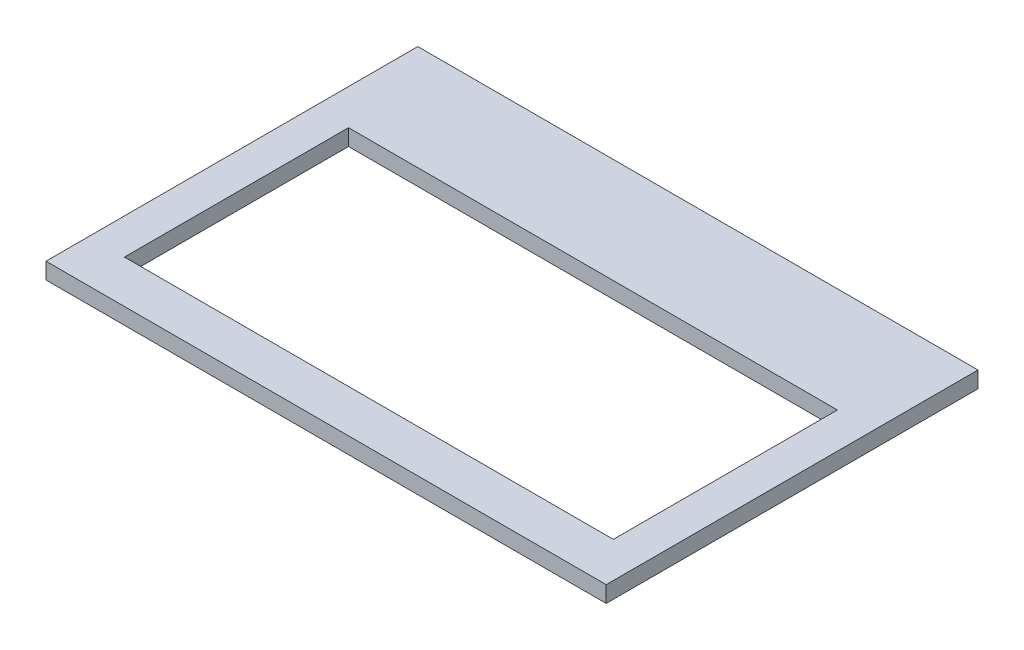
from build123d import *

# Parameters (mm, degrees)
SZKIC1_W                    = 550
SZKIC1_H                    = 365
DODANIE_WYCI_GNI_CIE1_DEPTH = 16
SZKIC2_W                    = 480
SZKIC2_H                    = 220
WYTNIJ_WYCI_GNI_CIE1_DEPTH  = 16


with BuildPart() as part:
    # Szkic1 → Dodanie-wyciągnięcie1 (new body)
    with BuildSketch(Plane(origin=(0, 0, 0), x_dir=(1, 0, 0), z_dir=(0, 1, 0))):
        Rectangle(SZKIC1_W, SZKIC1_H)
    extrude(amount=DODANIE_WYCI_GNI_CIE1_DEPTH)

    # Szkic2 → Wytnij-wyciągnięcie1 (cut)
    with BuildSketch(Plane(origin=(0, 16, 0), x_dir=(1, 0, 0), z_dir=(0, 1, 0))):
        with Locations((0, -30.5)):
            Rectangle(SZKIC2_W, SZKIC2_H)
    extrude(amount=-WYTNIJ_WYCI_GNI_CIE1_DEPTH, mode=Mode.SUBTRACT)


solid = part.part
